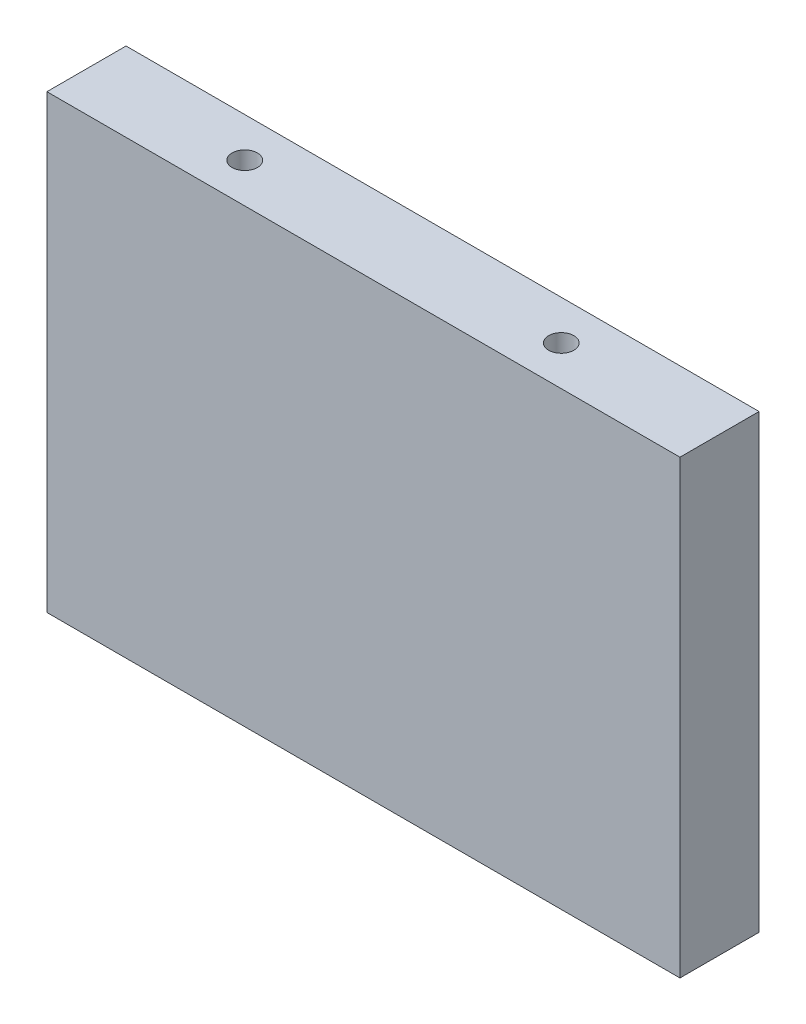
from build123d import *

# Parameters (mm, degrees)
SKETCH1_W                  = 40
SKETCH1_H                  = 28.5
BOSS_EXTRUDE1_DEPTH        = 5
M2_TAPPED_HOLE1_AT_2_COUNT = 2
M2_TAPPED_HOLE1_AT_2_PITCH = 20


with BuildPart() as part:
    # Sketch1 → Boss-Extrude1 (new body)
    with BuildSketch(Plane.XY):
        Rectangle(SKETCH1_W, SKETCH1_H)
    extrude(amount=BOSS_EXTRUDE1_DEPTH)

    # Sketch4 → M2 Tapped Hole1 (revolve, cut)
    with BuildSketch(Plane(origin=(-10, 14.25, 2.5), x_dir=(0, 0, 1), z_dir=(1, 0, 0))):
        Polygon((0, 0), (0, 5.480688495), (0.8, 5), (0.8, 0), align=None)
    m2_tapped_hole1 = revolve(axis=Axis((-10, 20.6, 2.5), (0, -1, 0)), mode=Mode.SUBTRACT)

    # M2 Tapped Hole1 at 2: M2 Tapped Hole1 ×2
    with Locations(*[(i * M2_TAPPED_HOLE1_AT_2_PITCH, 0, 0) for i in range(1, M2_TAPPED_HOLE1_AT_2_COUNT)]):
        add(m2_tapped_hole1, mode=Mode.SUBTRACT)

    # Mirror1: M2 Tapped Hole1 across plane
    add(m2_tapped_hole1.mirror(Plane.ZX), mode=Mode.SUBTRACT)

    # Mirror1 copy 1 sketch → Mirror1 copy 1 (revolve, cut)
    with BuildSketch(Plane(origin=(10, -14.25, 2.5), x_dir=(0, 0, 1), z_dir=(1, 0, 0))):
        Polygon((0, 0), (0, -5.480688495), (0.8, -5), (0.8, 0), align=None)
    revolve(axis=Axis((10, -20.6, 2.5), (0, -1, 0)), mode=Mode.SUBTRACT)


solid = part.part
